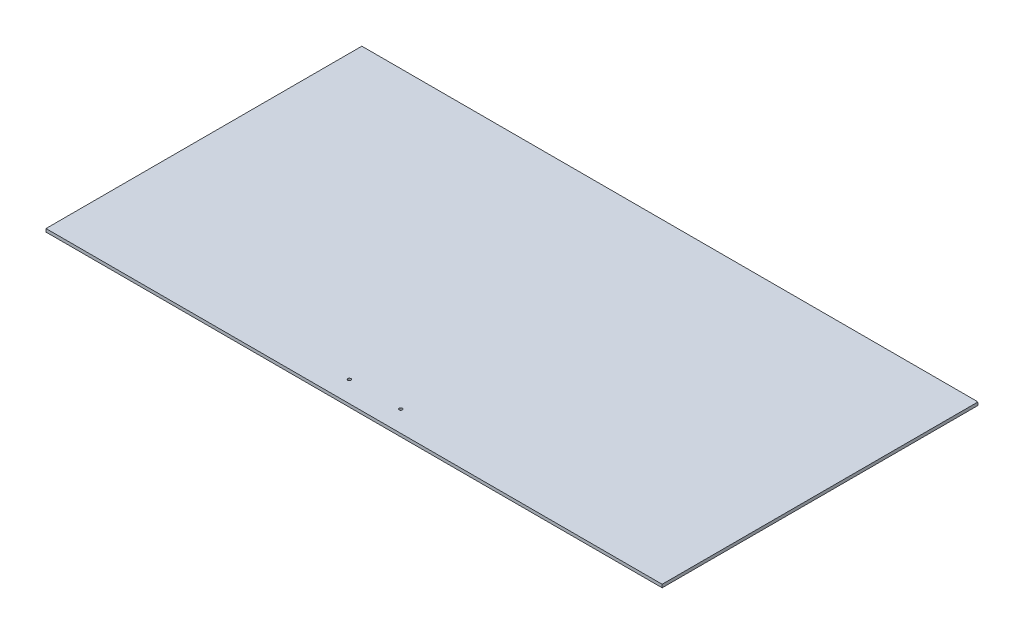
from build123d import *

# Parameters (mm, degrees)
SKETCH1_W           = 1257.3
SKETCH1_H           = 644.525
BOSS_EXTRUDE1_DEPTH = 6.35
SKETCH2_R           = 3.175
CUT_EXTRUDE1_DEPTH  = 707.466038749
SKETCH3_R           = 2.54
CUT_EXTRUDE2_DEPTH  = 2.54


with BuildPart() as part:
    # Sketch1 → Boss-Extrude1 (new body)
    with BuildSketch(Plane(origin=(0, 0, 0), x_dir=(1, 0, 0), z_dir=(0, 1, 0))):
        Rectangle(SKETCH1_W, SKETCH1_H)
    extrude(amount=BOSS_EXTRUDE1_DEPTH)

    # Sketch2 → Cut-Extrude1 (cut, through all)
    with BuildSketch(Plane(origin=(0, 6.35, 0), x_dir=(1, 0, 0), z_dir=(0, 1, 0))):
        with Locations(Location((-52.3875, -279.4, 0), (0, 0, 270))):
            Circle(SKETCH2_R)
        with Locations(Location((52.3875, -279.4, 0), (0, 0, 270))):
            Circle(SKETCH2_R)
    extrude(amount=-CUT_EXTRUDE1_DEPTH, mode=Mode.SUBTRACT)

    # Sketch3 → Cut-Extrude2 (cut)
    with BuildSketch(Plane(origin=(628.65, 0, 0), x_dir=(0, 0, -1), z_dir=(1, 0, 0))):
        with Locations((323.5325, 7.62)):
            Circle(SKETCH3_R)
    extrude(amount=-CUT_EXTRUDE2_DEPTH, mode=Mode.SUBTRACT)


solid = part.part
